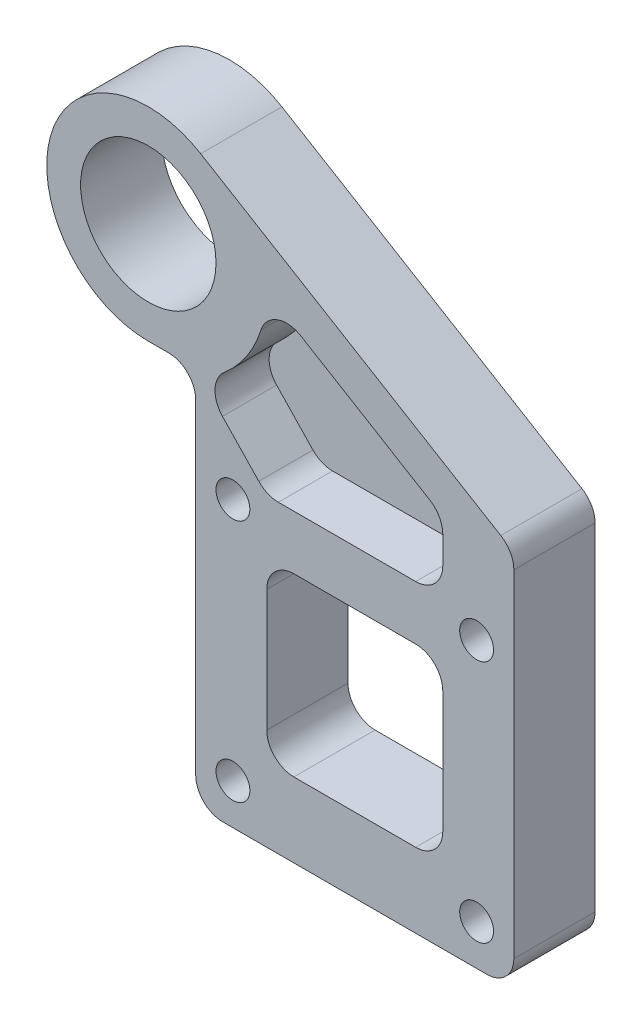
from build123d import *

# Parameters (mm, degrees)
SKETCH_1_R          = 7.5
SKETCH_1_R_2        = 5
SKETCH_1_W          = 23.5
SKETCH_1_H          = 32
SKETCH_1_R_3        = 1.25
EXTRUDE_1_DEPTH     = 6
SKETCH_3_W          = 23.5
SKETCH_3_H          = 4
SKETCH_3_W_2        = 13
SKETCH_3_H_2        = 13
CUT_EXTRUDE_1_DEPTH = 7
CUT_EXTRUDE_2_DEPTH = 4
FILLET_2_R          = 2


with BuildPart() as part:
    # 草图1 → 凸台-拉伸1 (new body)
    # profile 1 of 3: a face of its own
    with BuildSketch(Plane.XY):
        with BuildLine():
            Line((-15.25, 16), (-11.75, 16))
            Line((-11.75, 16), (11.75, 16))
            Line((11.75, 16), (-11.381805158, 29.925501433))
            ThreePointArc((-11.381805158, 29.925501433), (-8.72077871, 27.190429425), (-7.75, 23.5))
            ThreePointArc((-7.75, 23.5), (-9.946699141, 18.196699141), (-15.25, 16))
        make_face()
    # profile 2 of 3: a face of its own
    with BuildSketch(Plane.XY):
        with Locations((-15.25, 23.5)):
            Circle(SKETCH_1_R)
        with Locations((-15.25, 23.5)):
            Circle(SKETCH_1_R_2, mode=Mode.SUBTRACT)
    # profile 3 of 3: a face of its own
    with BuildSketch(Plane.XY):
        Rectangle(SKETCH_1_W, SKETCH_1_H)
        with Locations((9, -9)):
            Circle(SKETCH_1_R_3, mode=Mode.SUBTRACT)
        with Locations((-9, -9)):
            Circle(SKETCH_1_R_3, mode=Mode.SUBTRACT)
        with Locations((-9, 9)):
            Circle(SKETCH_1_R_3, mode=Mode.SUBTRACT)
        with Locations((9, 9)):
            Circle(SKETCH_1_R_3, mode=Mode.SUBTRACT)
    extrude(amount=EXTRUDE_1_DEPTH)

    # 草图3 → 切除-拉伸1 (cut)
    with BuildSketch(Plane.XY.offset(6)):
        with Locations((0, -14)):
            Rectangle(SKETCH_3_W, SKETCH_3_H)
        Rectangle(SKETCH_3_W_2, SKETCH_3_H_2)
    extrude(amount=-CUT_EXTRUDE_1_DEPTH, mode=Mode.SUBTRACT)

    # 草图4 → 切除-拉伸2 (cut)
    with BuildSketch(Plane.XY.offset(6)):
        with BuildLine():
            Line((6.5, 15.658862876), (-6.525, 23.5))
            ThreePointArc((-6.525, 23.5), (-7.850272246, 18.877267672), (-11.423488063, 15.658862876))
            Line((-11.423488063, 15.658862876), (6.5, 15.658862876))
        make_face()
        Polygon((-6.5, 10.5), (6.5, 10.5), (6.5, 15.658862876), (-11.423488063, 15.658862876), align=None)
    extrude(amount=-CUT_EXTRUDE_2_DEPTH, mode=Mode.SUBTRACT)

    # 圆角2
    fillet_2_edges = [part.edges().sort_by_distance(p)[0] for p in [
        (11.75, 16, 3),
        (-11.75, 16, 3),
        (-11.75, -12, 3),
        (11.75, -12, 3),
        (6.5, 6.5, 3),
        (6.5, -6.5, 3),
        (-6.5, -6.5, 3),
        (-6.5, 6.5, 3),
        (-11.423488063, 15.658862876, 4),
        (-6.525, 23.5, 4),
        (6.5, 15.658862876, 4),
        (6.5, 10.5, 4),
        (-6.5, 10.5, 4),
    ]]
    fillet(fillet_2_edges, radius=FILLET_2_R)


solid = part.part
